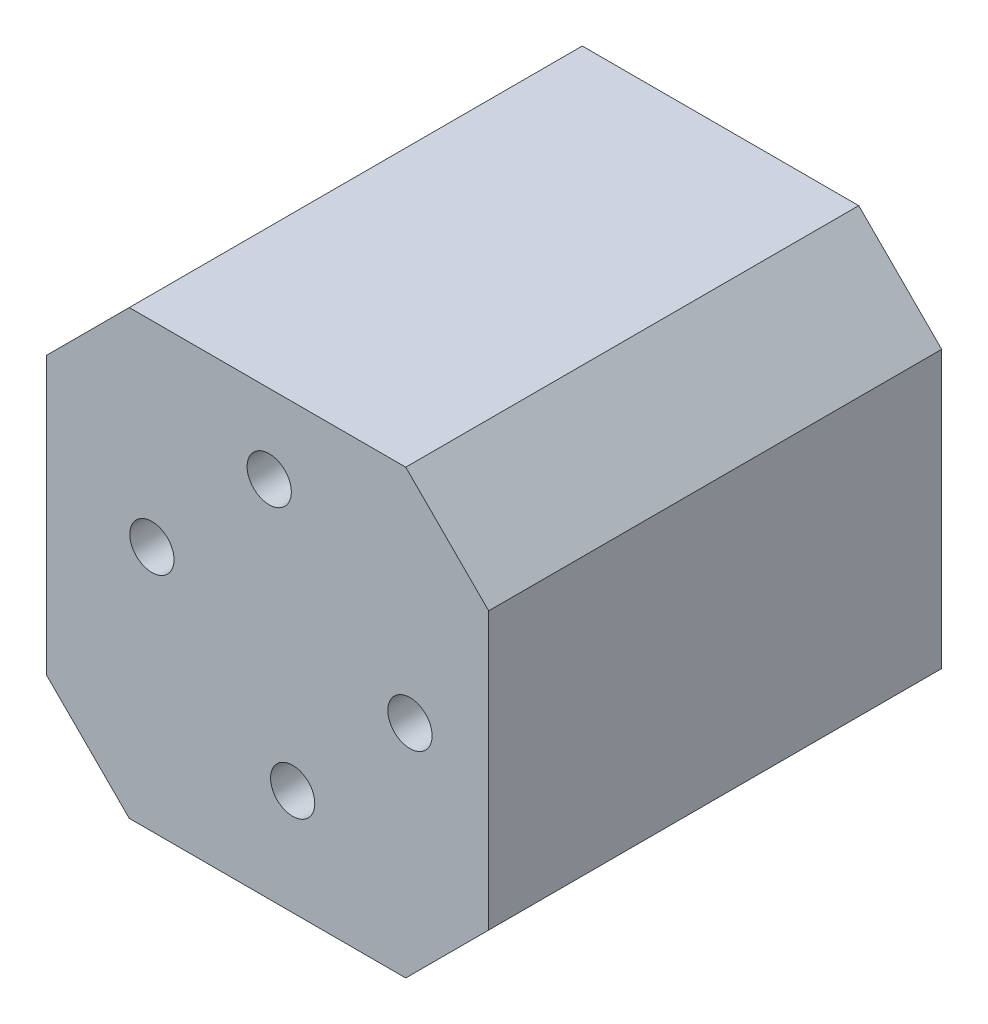
from build123d import *

# Parameters (mm, degrees)
BOSS_EXTRUDE1_DEPTH = 40.96
SKETCH2_R           = 2
CUT_EXTRUDE1_DEPTH  = 70.840687282


with BuildPart() as part:
    # Sketch1 → Boss-Extrude1 (new body)
    with BuildSketch(Plane.XY):
        Polygon((7.5, 40), (0, 32.5), (0, 7.5), (7.5, 0), (32.5, 0), (40, 7.5), (40, 32.5), (32.5, 40), align=None)
    extrude(amount=BOSS_EXTRUDE1_DEPTH)

    # Sketch2 → Cut-Extrude1 (cut, through all)
    with BuildSketch(Plane.XY.offset(40.96)):
        with Locations((20.154370806, 32.88225099)):
            Circle(SKETCH2_R)
        with Locations((9.547769088, 22.275649272)):
            Circle(SKETCH2_R)
        with Locations((22.275691149, 9.547727211)):
            Circle(SKETCH2_R)
        with Locations((32.882292867, 20.154328929)):
            Circle(SKETCH2_R)
    extrude(amount=-CUT_EXTRUDE1_DEPTH, mode=Mode.SUBTRACT)


solid = part.part
